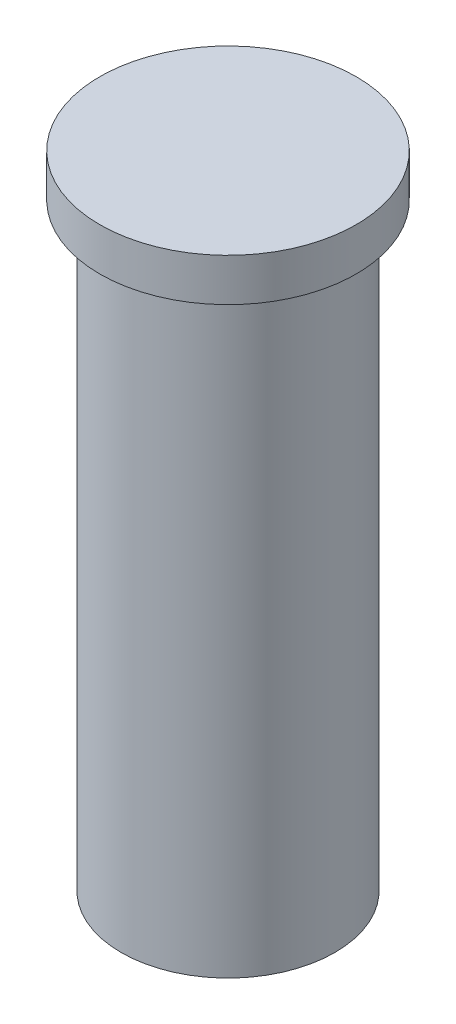
from build123d import *

# Parameters (mm, degrees)
SKETCH_1_R      = 25
EXTRUDE_1_DEPTH = 150
SKETCH_2_R      = 30
EXTRUDE_2_DEPTH = 10


with BuildPart() as part:
    # 草图1 → 凸台-拉伸1 (new body)
    with BuildSketch(Plane(origin=(0, 0, 0), x_dir=(1, 0, 0), z_dir=(0, 1, 0))):
        with Locations(Location((0, 0, 0), (0, 0, 270))):
            Circle(SKETCH_1_R)
    extrude(amount=EXTRUDE_1_DEPTH)

    # 草图2 → 凸台-拉伸2 (add)
    with BuildSketch(Plane(origin=(0, 150, 0), x_dir=(1, 0, 0), z_dir=(0, 1, 0))):
        with Locations(Location((0, 0, 0), (0, 0, 270))):
            Circle(SKETCH_2_R)
    extrude(amount=-EXTRUDE_2_DEPTH)


solid = part.part
